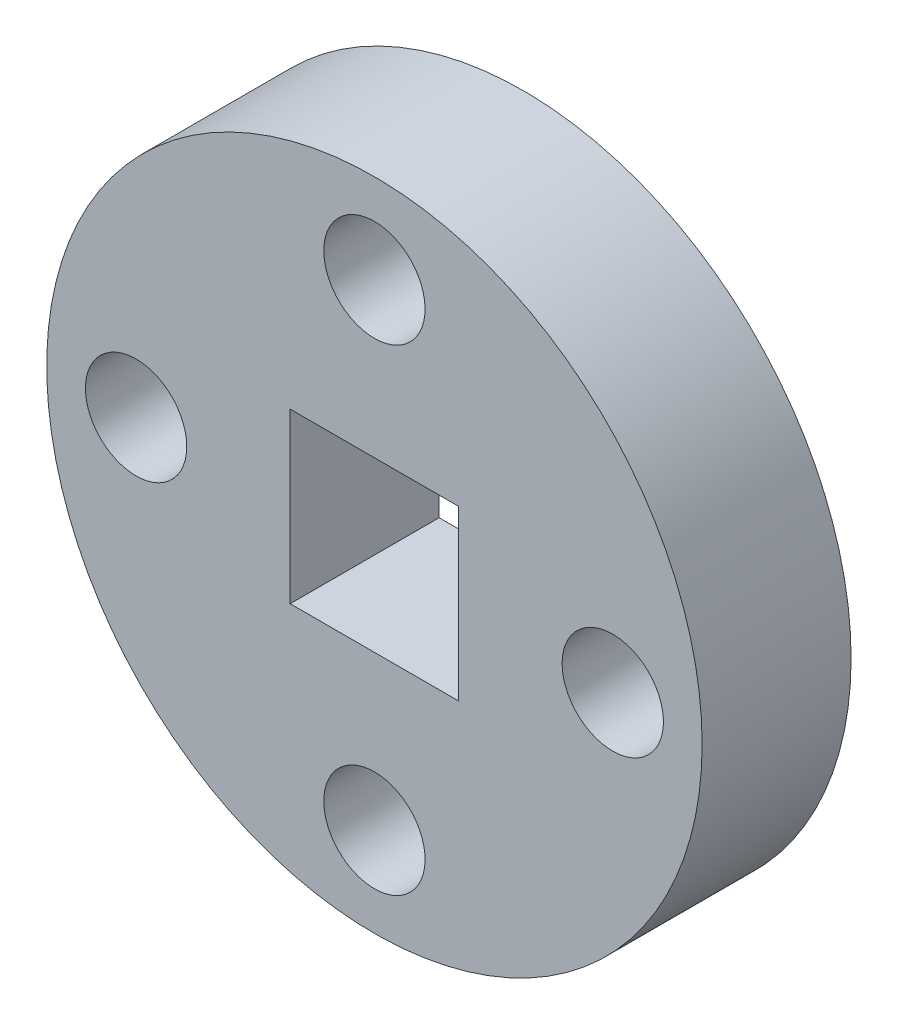
from build123d import *

# Parameters (mm, degrees)
SKETCH1_R             = 11
SKETCH1_W             = 5.65685425
SKETCH1_H             = 5.65685425
BOSS_EXTRUDE1_DEPTH   = 5
F_2_0MM_DOWEL_HOLE1_D = 2
SKETCH4_R             = 1.7
CUT_EXTRUDE1_DEPTH    = 2.5
CIRPATTERN1_COUNT     = 4


with BuildPart() as part:
    # Sketch1 → Boss-Extrude1 (new body)
    with BuildSketch(Plane(origin=(0, 0, 0), x_dir=(0, 1, 0), z_dir=(0, 0, 1))):
        with Locations(Location((0, 0, 0), (0, 0, 270))):
            Circle(SKETCH1_R)
        Rectangle(SKETCH1_W, SKETCH1_H, mode=Mode.SUBTRACT)
    extrude(amount=BOSS_EXTRUDE1_DEPTH)

    # Ø2.0mm Dowel Hole1 (through all)
    with Locations(Plane.XY.offset(5)):
        with Locations((8, 0), (0, 8), (-8, 0), (0, -8)):
            Hole(F_2_0MM_DOWEL_HOLE1_D / 2)

    # Sketch4 → Cut-Extrude1 (cut)
    with BuildSketch(Plane.XY.offset(5)):
        with Locations((-8, 0)):
            Circle(SKETCH4_R)
    cut_extrude1 = extrude(amount=-CUT_EXTRUDE1_DEPTH, mode=Mode.SUBTRACT)

    # CirPattern1: Cut-Extrude1 ×4 about axis
    cirpattern1_axis = Axis((0, 0, 0), (0, 0, 1))
    for i in range(1, CIRPATTERN1_COUNT):
        add(cut_extrude1.rotate(cirpattern1_axis, i * 360 / CIRPATTERN1_COUNT), mode=Mode.SUBTRACT)


solid = part.part
